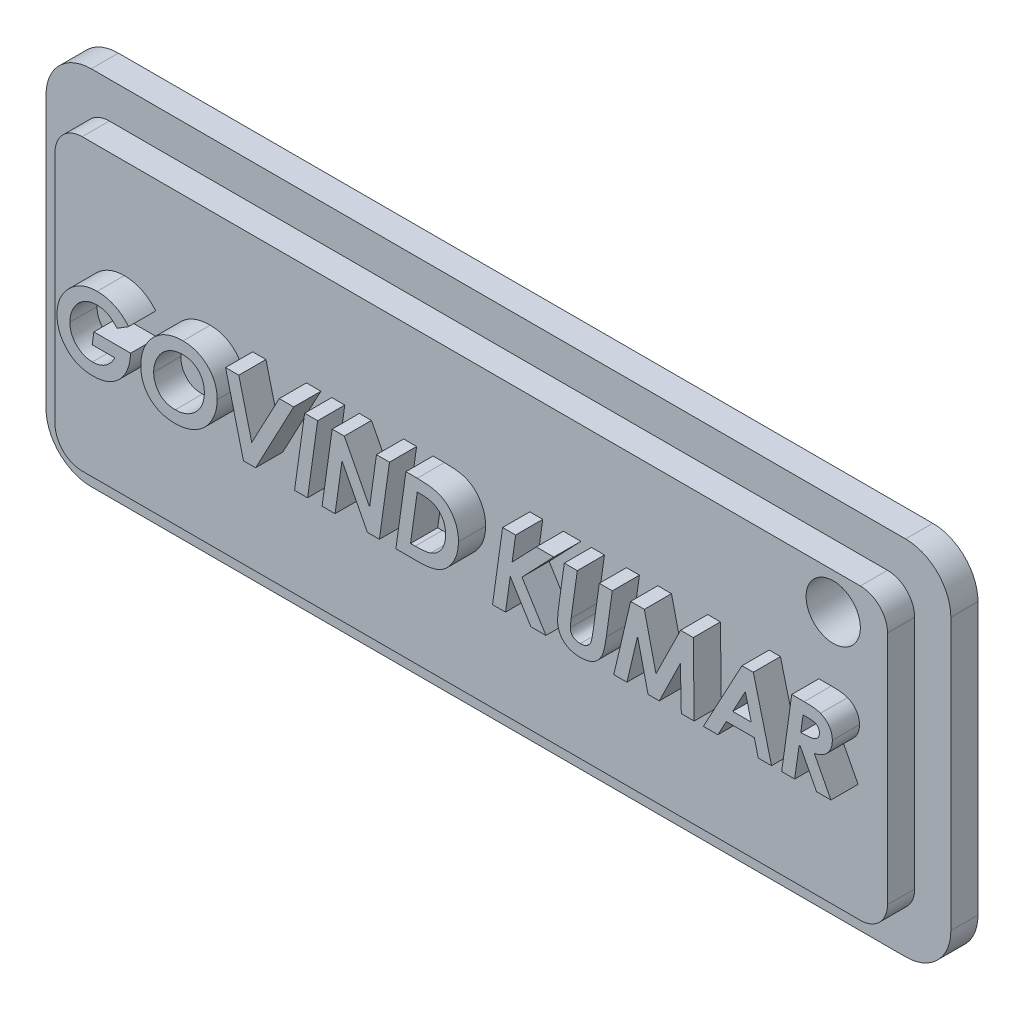
from build123d import *

# Parameters (mm, degrees)
BOSS_EXTRUDE1_DEPTH = 1.5
BOSS_EXTRUDE2_DEPTH = 1.5
BOSS_EXTRUDE3_DEPTH = 1.5
SKETCH4_R           = 1.5
CUT_EXTRUDE1_DEPTH  = 3


with BuildPart() as part:
    # Sketch1 → Boss-Extrude1 (new body)
    with BuildSketch(Plane.XY):
        with BuildLine():
            Line((-22.5, -10), (22.5, -10))
            ThreePointArc((22.5, -10), (24.267766953, -9.267766953), (25, -7.5))
            Line((25, -7.5), (25, 7.5))
            ThreePointArc((25, 7.5), (24.267766953, 9.267766953), (22.5, 10))
            Line((22.5, 10), (-22.5, 10))
            ThreePointArc((-22.5, 10), (-24.267766953, 9.267766953), (-25, 7.5))
            Line((-25, 7.5), (-25, -7.5))
            ThreePointArc((-25, -7.5), (-24.267766953, -9.267766953), (-22.5, -10))
        make_face()
    extrude(amount=BOSS_EXTRUDE1_DEPTH)

    # Sketch2 → Boss-Extrude2 (add)
    with BuildSketch(Plane.XY.offset(1.5)):
        with BuildLine():
            Line((-21.5, -8), (21.5, -8))
            ThreePointArc((21.5, -8), (22.560660172, -7.560660172), (23, -6.5))
            Line((23, -6.5), (23, 6.5))
            ThreePointArc((23, 6.5), (22.560660172, 7.560660172), (21.5, 8))
            Line((21.5, 8), (-21.5, 8))
            ThreePointArc((-21.5, 8), (-22.560660172, 7.560660172), (-23, 6.5))
            Line((-23, 6.5), (-23, -6.5))
            ThreePointArc((-23, -6.5), (-22.560660172, -7.560660172), (-21.5, -8))
        make_face()
    extrude(amount=BOSS_EXTRUDE2_DEPTH)

    # Sketch3 → Boss-Extrude3 (add)
    # profile 1 of 11: a face of its own
    with BuildSketch(Plane.XY.offset(3)):
        with BuildLine():
            Line((-17.439481473, 1.690738202), (-18.071523991, 1.294817229))
            add(Edge.make_bspline(
                [(-18.071523991, 1.294817229), (-18.116351478, 1.343784053), (-18.201988278, 1.437328493), (-18.336309952, 1.559636375), (-18.468627622, 1.658135293), (-18.600990723, 1.733121209), (-18.736411558, 1.788807334), (-18.87867327, 1.826272761), (-19.029256706, 1.850098156), (-19.132520964, 1.853018649), (-19.185349863, 1.854512741)],
                knots=[0, 0, 0, 0, 1.232977487, 2.355435308, 3.369770187, 4.291348691, 5.174604885, 6.082334442, 7.018942652, 8, 8, 8, 8], degree=3))
            add(Edge.make_bspline(
                [(-19.185349863, 1.854512741), (-19.242711013, 1.852992324), (-19.355446057, 1.850004163), (-19.519870343, 1.821727312), (-19.676535594, 1.778480084), (-19.82477147, 1.715839158), (-19.964667545, 1.634784512), (-20.096391673, 1.536322731), (-20.220035956, 1.420358313), (-20.292960555, 1.331977147), (-20.330181593, 1.286867008)],
                knots=[0, 0, 0, 0, 1.037106879, 2.038283569, 3.009830787, 3.972569298, 4.94146214, 5.928319872, 6.942605276, 8, 8, 8, 8], degree=3))
            add(Edge.make_bspline(
                [(-20.330181593, 1.286867008), (-20.358142366, 1.249157914), (-20.413377543, 1.174665393), (-20.483883061, 1.056114608), (-20.544637786, 0.935391205), (-20.594442716, 0.811287074), (-20.632551251, 0.684045293), (-20.659466099, 0.55341511), (-20.67686392, 0.419966779), (-20.678945092, 0.329713963), (-20.679991289, 0.284344222)],
                knots=[0, 0, 0, 0, 1.040960542, 2.056368018, 3.055559505, 4.03710588, 5.019268411, 5.998275661, 6.99374091, 8, 8, 8, 8], degree=3))
            add(Edge.make_bspline(
                [(-20.679991289, 0.284344222), (-20.678920736, 0.240042182), (-20.676810264, 0.152705792), (-20.660183607, 0.024498406), (-20.630884437, -0.097939322), (-20.592466031, -0.215537592), (-20.541018732, -0.327230591), (-20.478746549, -0.433520932), (-20.40513934, -0.534120687), (-20.321114053, -0.628191381), (-20.229175747, -0.714078375), (-20.131019193, -0.789357335), (-20.027601877, -0.852720413), (-19.918882334, -0.904605902), (-19.80492823, -0.945444581), (-19.685460159, -0.973766127), (-19.56116317, -0.991989571), (-19.476392792, -0.993884907), (-19.433396738, -0.994846233)],
                knots=[0, 0, 0, 0, 1.066897471, 2.103265977, 3.106535126, 4.095591644, 5.078159493, 6.062322472, 7.058152725, 8.075375883, 9.096057735, 10.084186963, 11.049730852, 12.011871914, 12.980953841, 13.959387168, 14.96498868, 16, 16, 16, 16], degree=3))
            add(Edge.make_bspline(
                [(-19.433396738, -0.994846233), (-19.40104241, -0.99424679), (-19.336986338, -0.993059995), (-19.242139745, -0.983240949), (-19.149445616, -0.967292368), (-19.059027221, -0.94525272), (-18.970894127, -0.916273433), (-18.88486051, -0.881146441), (-18.800689123, -0.840102091), (-18.719317713, -0.791931497), (-18.640615922, -0.738183764), (-18.565696355, -0.677513718), (-18.494726944, -0.610297392), (-18.427138777, -0.536888786), (-18.362490402, -0.457679315), (-18.303087298, -0.371014097), (-18.246276757, -0.278805573), (-18.212130201, -0.213817343), (-18.194752407, -0.180743669)],
                knots=[0, 0, 0, 0, 0.990751711, 1.961520103, 2.916931976, 3.869720035, 4.809138875, 5.755683625, 6.713987145, 7.674487982, 8.649319602, 9.630449541, 10.623757948, 11.640402946, 12.684918653, 13.752145235, 14.856026455, 16, 16, 16, 16], degree=3))
            Line((-18.194752407, -0.180743669), (-19.447707134, -0.180743669))
            Line((-19.447707134, -0.180743669), (-19.357074622, 0.480714664))
            Line((-19.357074622, 0.480714664), (-17.321818212, 0.480714664))
            add(Edge.make_bspline(
                [(-17.321818212, 0.480714664), (-17.326909079, 0.400823684), (-17.33686448, 0.24459357), (-17.372892264, 0.01710392), (-17.426250851, -0.197435004), (-17.495415964, -0.399849809), (-17.5810859, -0.58976296), (-17.684592095, -0.766659704), (-17.803906474, -0.931205137), (-17.940112922, -1.081242191), (-18.08925953, -1.215868382), (-18.248557952, -1.334806933), (-18.419217703, -1.433464539), (-18.598963806, -1.514961655), (-18.788503697, -1.57906014), (-18.988319277, -1.62399739), (-19.198083731, -1.651696479), (-19.341352245, -1.654749646), (-19.414316209, -1.656304566)],
                knots=[0, 0, 0, 0, 1.148955532, 2.246830018, 3.301660101, 4.319666133, 5.314146826, 6.287838685, 7.257462643, 8.227280698, 9.191724348, 10.138440807, 11.076252923, 12.016254752, 12.968042649, 13.943717582, 14.952773983, 16, 16, 16, 16], degree=3))
            add(Edge.make_bspline(
                [(-19.414316209, -1.656304566), (-19.454344702, -1.655907645), (-19.533423689, -1.6551235), (-19.65019217, -1.647068102), (-19.763679591, -1.633315318), (-19.873814636, -1.615250845), (-19.981082877, -1.592161826), (-20.084932806, -1.563728862), (-20.185605403, -1.52955106), (-20.2824708, -1.489056712), (-20.377591603, -1.446330909), (-20.468015471, -1.395432512), (-20.555965486, -1.340799677), (-20.640058789, -1.280071301), (-20.721562994, -1.214861413), (-20.799243437, -1.144126722), (-20.873779835, -1.068147444), (-20.920374162, -1.014186181), (-20.943938605, -0.986896013)],
                knots=[0, 0, 0, 0, 1.111499042, 2.195841241, 3.24834816, 4.285223882, 5.294222847, 6.294054786, 7.273859608, 8.244193736, 9.208986092, 10.167555097, 11.123181443, 12.083077344, 13.046240314, 14.020501641, 14.998895854, 16, 16, 16, 16], degree=3))
            add(Edge.make_bspline(
                [(-20.943938605, -0.986896013), (-20.979757951, -0.941658601), (-21.050875835, -0.851841523), (-21.142172346, -0.707120728), (-21.220082738, -0.556191883), (-21.282474445, -0.398283857), (-21.332353846, -0.234615366), (-21.367172913, -0.064286971), (-21.388120833, 0.112357925), (-21.390915984, 0.232345601), (-21.392331032, 0.293089464)],
                knots=[0, 0, 0, 0, 0.999328569, 1.984127054, 2.959716786, 3.938705326, 4.922250225, 5.921072174, 6.947541011, 8, 8, 8, 8], degree=3))
            add(Edge.make_bspline(
                [(-21.392331032, 0.293089464), (-21.390430304, 0.367408868), (-21.386679701, 0.514059254), (-21.354340299, 0.7296697), (-21.304037845, 0.938015859), (-21.230845716, 1.138054377), (-21.138451577, 1.330920477), (-21.024311009, 1.515134328), (-20.891188632, 1.692745358), (-20.73792198, 1.85891835), (-20.571711119, 2.012494446), (-20.395221231, 2.147395591), (-20.210154426, 2.260945648), (-20.018020619, 2.354978534), (-19.816985815, 2.426475285), (-19.608816974, 2.478220084), (-19.392519767, 2.510285072), (-19.245617261, 2.51405646), (-19.171039466, 2.515971075)],
                knots=[0, 0, 0, 0, 1.022519879, 2.01768214, 2.99445506, 3.968403767, 4.944092992, 5.933246428, 6.946641619, 7.994936793, 9.040543676, 10.058341478, 11.047494914, 12.024771785, 12.997483176, 13.978673844, 14.973836105, 16, 16, 16, 16], degree=3))
            add(Edge.make_bspline(
                [(-19.171039466, 2.515971075), (-19.115066079, 2.515063972), (-19.00360935, 2.513257707), (-18.837933718, 2.493692794), (-18.674059245, 2.464940108), (-18.513573203, 2.422362574), (-18.357529816, 2.370434839), (-18.20804842, 2.308271009), (-18.06657112, 2.236068434), (-17.932049674, 2.153105964), (-17.803148356, 2.058431366), (-17.677430576, 1.950286014), (-17.555289882, 1.827107764), (-17.478640327, 1.736849497), (-17.439481473, 1.690738202)],
                knots=[0, 0, 0, 0, 1.014010841, 2.019144067, 3.019687909, 4.027399918, 5.025300219, 5.998481464, 6.958680332, 7.901091373, 8.859847597, 9.854378501, 10.903841272, 12, 12, 12, 12], degree=3))
        make_face()
    # profile 2 of 11: a face of its own
    with BuildSketch(Plane.XY.offset(3)):
        with BuildLine():
            add(Edge.make_bspline(
                [(-14.425552937, 2.515971075), (-14.358691038, 2.514567836), (-14.227409686, 2.51181262), (-14.034979258, 2.48645795), (-13.851396786, 2.445591464), (-13.677109562, 2.386989893), (-13.511448406, 2.312957129), (-13.354811948, 2.221721192), (-13.207371221, 2.11392602), (-13.070326738, 1.991032203), (-12.946190525, 1.855625294), (-12.836107828, 1.710697643), (-12.744685341, 1.555590035), (-12.669396417, 1.39202964), (-12.610046554, 1.219837619), (-12.569561411, 1.038186498), (-12.542838002, 0.848279909), (-12.540272266, 0.718520324), (-12.538965648, 0.652439424)],
                knots=[0, 0, 0, 0, 1.079937363, 2.120424901, 3.130164457, 4.114608815, 5.086352068, 6.057283592, 7.037967613, 8.032612779, 9.026667848, 10.002130715, 10.967845321, 11.92966918, 12.907375778, 13.904589319, 14.932898699, 16, 16, 16, 16], degree=3))
            add(Edge.make_bspline(
                [(-12.538965648, 0.652439424), (-12.539802452, 0.600989437), (-12.54146679, 0.498659401), (-12.557303752, 0.346504988), (-12.581975598, 0.19650988), (-12.615757225, 0.048630784), (-12.660977288, -0.096658004), (-12.714955575, -0.240217306), (-12.779349644, -0.381459762), (-12.853302765, -0.519291366), (-12.934316715, -0.652088574), (-13.023112962, -0.777658181), (-13.118507177, -0.895254954), (-13.220133248, -1.005341861), (-13.329088534, -1.106445126), (-13.44324346, -1.200682782), (-13.565070989, -1.285912784), (-13.692637109, -1.36376337), (-13.826208434, -1.432951795), (-13.964882389, -1.492751915), (-14.108478492, -1.542750278), (-14.256657683, -1.584085861), (-14.409785959, -1.616970772), (-14.567834967, -1.639687666), (-14.73086015, -1.653474311), (-14.841057251, -1.655351549), (-14.897001004, -1.656304566)],
                knots=[0, 0, 0, 0, 1.005311864, 1.999487392, 2.986390894, 3.975195422, 4.961487101, 5.958115224, 6.97104375, 7.992937587, 9.013623077, 10.009524137, 10.996414046, 11.971324635, 12.935123389, 13.899409138, 14.862205298, 15.838449601, 16.81836937, 17.799766407, 18.787539403, 19.787875373, 20.804768927, 21.846385261, 22.906674593, 24, 24, 24, 24], degree=3))
            add(Edge.make_bspline(
                [(-14.897001004, -1.656304566), (-14.966243819, -1.654877607), (-15.101448444, -1.652091304), (-15.298499935, -1.627482781), (-15.484939704, -1.589060388), (-15.660776344, -1.53405585), (-15.826337423, -1.4631284), (-15.981076584, -1.376097676), (-16.125372711, -1.27391257), (-16.256806865, -1.155848778), (-16.376320705, -1.026343877), (-16.478948348, -0.884321026), (-16.567573368, -0.733614449), (-16.637884686, -0.571754723), (-16.694146209, -0.400728092), (-16.733344419, -0.219550728), (-16.757857362, -0.028507721), (-16.760679319, 0.102207538), (-16.762122699, 0.169066027)],
                knots=[0, 0, 0, 0, 1.129126937, 2.20475128, 3.23403939, 4.230775744, 5.204839333, 6.16680792, 7.121629951, 8.083044708, 9.04383724, 9.990659777, 10.936010704, 11.890255174, 12.863608629, 13.868449271, 14.909750384, 16, 16, 16, 16], degree=3))
            add(Edge.make_bspline(
                [(-16.762122699, 0.169066027), (-16.76038858, 0.24548842), (-16.756974008, 0.395968198), (-16.726958031, 0.61747275), (-16.681077804, 0.831284557), (-16.613475463, 1.036267545), (-16.52821952, 1.233199544), (-16.423211625, 1.421424871), (-16.300078817, 1.602469822), (-16.204081007, 1.713882655), (-16.155520886, 1.770240406)],
                knots=[0, 0, 0, 0, 1.045740506, 2.05911896, 3.05467723, 4.035585325, 5.008815224, 5.988058098, 6.982266978, 8, 8, 8, 8], degree=3))
            add(Edge.make_bspline(
                [(-16.155520886, 1.770240406), (-16.127252542, 1.800797182), (-16.071224818, 1.861360568), (-15.98155592, 1.945524317), (-15.889691993, 2.024322055), (-15.794332722, 2.096818354), (-15.696918314, 2.164696997), (-15.595896468, 2.225818616), (-15.491649326, 2.280846453), (-15.385310675, 2.331024679), (-15.275050835, 2.373869231), (-15.162775705, 2.412257975), (-15.046927172, 2.443932274), (-14.928321719, 2.47014844), (-14.806845813, 2.490993736), (-14.682338057, 2.504983566), (-14.555010273, 2.514036886), (-14.469029691, 2.5153215), (-14.425552937, 2.515971075)],
                knots=[0, 0, 0, 0, 1.027812829, 2.037120149, 3.035266778, 4.015768311, 4.994345575, 5.966422343, 6.929711672, 7.904780536, 8.86860337, 9.849672715, 10.834163809, 11.833018336, 12.848777673, 13.876590502, 14.926281379, 16, 16, 16, 16], degree=3))
        make_face()
        with BuildLine():
            add(Edge.make_bspline(
                [(-14.4422484, 1.854512741), (-14.47831528, 1.853973548), (-14.550070053, 1.852900828), (-14.656275525, 1.842113041), (-14.760344406, 1.825398278), (-14.861839432, 1.80249166), (-14.961247549, 1.772928188), (-15.057891954, 1.736393356), (-15.152486695, 1.693155802), (-15.243988877, 1.643264238), (-15.332705455, 1.587628209), (-15.4167839, 1.525537503), (-15.496815437, 1.45788097), (-15.571452994, 1.383465782), (-15.64233557, 1.303820972), (-15.709264739, 1.218785675), (-15.77140458, 1.127531677), (-15.829031477, 1.03157689), (-15.880185805, 0.931708274), (-15.925622222, 0.830998407), (-15.964291559, 0.729432955), (-15.994958638, 0.626735765), (-16.019993192, 0.523318529), (-16.037352356, 0.41890877), (-16.048130658, 0.313725143), (-16.049231607, 0.243293698), (-16.049782955, 0.208022106)],
                knots=[0, 0, 0, 0, 1.015557909, 2.02044445, 3.003357477, 3.982977463, 4.948851735, 5.922052592, 6.890662853, 7.875953625, 8.855459861, 9.837777552, 10.817397539, 11.804383193, 12.803598646, 13.818964529, 14.849984807, 15.911175445, 16.969421976, 18.008462528, 19.021851172, 20.027762868, 21.025304218, 22.016795393, 23.006824523, 24, 24, 24, 24], degree=3))
            add(Edge.make_bspline(
                [(-16.049782955, 0.208022106), (-16.048912528, 0.166899465), (-16.047199914, 0.085988415), (-16.032276487, -0.033117601), (-16.009154088, -0.147788064), (-15.974164878, -0.257072591), (-15.931649869, -0.362152789), (-15.87767036, -0.461458158), (-15.815618168, -0.556952288), (-15.743498049, -0.646209504), (-15.662943927, -0.728617854), (-15.572064917, -0.799714951), (-15.473173404, -0.860423242), (-15.365844663, -0.909823679), (-15.250167125, -0.948380617), (-15.125843321, -0.974580866), (-14.993420307, -0.991942693), (-14.902359138, -0.993861965), (-14.855659859, -0.994846233)],
                knots=[0, 0, 0, 0, 1.032572517, 2.031642993, 3.01079972, 3.966643664, 4.909863955, 5.853952978, 6.801111379, 7.766917104, 8.731873648, 9.689385086, 10.65752794, 11.640388645, 12.650815691, 13.713650281, 14.827481725, 16, 16, 16, 16], degree=3))
            add(Edge.make_bspline(
                [(-14.855659859, -0.994846233), (-14.800994235, -0.993554637), (-14.693051208, -0.991004244), (-14.534501828, -0.968288685), (-14.382301658, -0.930579963), (-14.236437632, -0.87905052), (-14.096862761, -0.812355864), (-13.963573582, -0.730956422), (-13.836914012, -0.63407569), (-13.717902939, -0.524247748), (-13.608577028, -0.404373613), (-13.513011438, -0.276259866), (-13.431853398, -0.141593215), (-13.365731455, -0.000668139), (-13.314570643, 0.146752568), (-13.278099939, 0.300409895), (-13.255084778, 0.460407068), (-13.252575874, 0.569413806), (-13.251305391, 0.624613653)],
                knots=[0, 0, 0, 0, 1.03369803, 2.041145535, 3.022357397, 3.995919545, 4.96236968, 5.943376615, 6.945032455, 7.973917545, 9.003120129, 10.009769043, 10.992465341, 11.972511115, 12.949140339, 13.93890809, 14.956285095, 16, 16, 16, 16], degree=3))
            add(Edge.make_bspline(
                [(-13.251305391, 0.624613653), (-13.252038331, 0.669982443), (-13.253474727, 0.758895034), (-13.270059853, 0.888366128), (-13.29525324, 1.011082408), (-13.330668462, 1.127005947), (-13.378370056, 1.235484571), (-13.43433232, 1.337853639), (-13.502106926, 1.432376432), (-13.578910482, 1.519365464), (-13.663823269, 1.598407579), (-13.756442773, 1.666558338), (-13.854754996, 1.725729491), (-13.960441366, 1.771892123), (-14.071589503, 1.810181089), (-14.189509481, 1.835922972), (-14.313850163, 1.85112484), (-14.398743188, 1.853364818), (-14.4422484, 1.854512741)],
                knots=[0, 0, 0, 0, 1.12845219, 2.211511647, 3.242392028, 4.243671568, 5.221368115, 6.186708094, 7.141970352, 8.109200861, 9.070590294, 10.022934043, 10.966237583, 11.91979086, 12.887493425, 13.887534174, 14.917422563, 16, 16, 16, 16], degree=3))
        make_face(mode=Mode.SUBTRACT)
    # profile 3 of 11: a face of its own
    with BuildSketch(Plane.XY.offset(3)):
        Polygon((-12.079442911, 2.414208254), (-11.346432595, 2.414208254), (-10.630912763, -0.451051161), (-9.11003561, 2.414208254), (-8.310243442, 2.414208254), (-10.417846858, -1.554541746), (-11.088050433, -1.554541746), align=None)
    # profile 4 of 11: a face of its own
    with BuildSketch(Plane.XY.offset(3)):
        Polygon((-7.708411762, 2.414208254), (-6.989711842, 2.414208254), (-7.546227266, -1.554541746), (-8.264927186, -1.554541746), align=None)
    # profile 5 of 11: a face of its own
    with BuildSketch(Plane.XY.offset(3)):
        Polygon((-6.186739586, 2.414208254), (-5.518126054, 2.414208254), (-4.11809225, -0.284096533), (-3.739661762, 2.414208254), (-3.020961842, 2.414208254), (-3.576682244, -1.554541746), (-4.239730622, -1.554541746), (-5.644534558, 1.173178857), (-6.026145135, -1.554541746), (-6.744845055, -1.554541746), align=None)
    # profile 6 of 11: a face of its own
    with BuildSketch(Plane.XY.offset(3)):
        with BuildLine():
            Line((-2.111456633, 2.414208254), (-1.48497927, 2.414208254))
            add(Edge.make_bspline(
                [(-1.48497927, 2.414208254), (-1.413947364, 2.413621593), (-1.276585451, 2.412487104), (-1.077386576, 2.403132959), (-0.89251271, 2.386622578), (-0.721625573, 2.363771063), (-0.564711273, 2.334616592), (-0.421709879, 2.299314201), (-0.292478866, 2.257550335), (-0.176658133, 2.207369921), (-0.07001469, 2.151060273), (0.029924861, 2.086808246), (0.124881819, 2.015416282), (0.215496531, 1.937336105), (0.299932204, 1.850852653), (0.379377075, 1.756877504), (0.454135234, 1.655614379), (0.523954476, 1.548114531), (0.58675752, 1.434453572), (0.641620824, 1.315655312), (0.688724353, 1.192846399), (0.725980585, 1.06535268), (0.755432751, 0.933897061), (0.776842712, 0.797967089), (0.78991209, 0.657733137), (0.791274411, 0.562895199), (0.791963839, 0.514900612)],
                knots=[0, 0, 0, 0, 1.508928034, 2.917973822, 4.235011166, 5.450779055, 6.579221784, 7.623755204, 8.577985451, 9.460610614, 10.301756591, 11.137250569, 11.981705789, 12.823774396, 13.675702816, 14.546470419, 15.435981066, 16.347923198, 17.267651715, 18.192054867, 19.125737078, 20.059147693, 21.011116727, 21.985721956, 22.980635317, 24, 24, 24, 24], degree=3))
            add(Edge.make_bspline(
                [(0.791963839, 0.514900612), (0.790995148, 0.465314506), (0.789069738, 0.366755196), (0.775254084, 0.220702704), (0.7529114, 0.077607961), (0.722114367, -0.062479305), (0.681553637, -0.199614971), (0.630909149, -0.333076496), (0.573243466, -0.464198784), (0.505478838, -0.590285199), (0.43239894, -0.711347577), (0.353276811, -0.824545654), (0.270290676, -0.929757258), (0.18135385, -1.025539004), (0.088174683, -1.113255821), (-0.009281426, -1.192905687), (-0.112065818, -1.263383743), (-0.220062876, -1.325942091), (-0.336147859, -1.380779582), (-0.462097901, -1.427234825), (-0.598300089, -1.467162086), (-0.745406332, -1.498332223), (-0.902714885, -1.523778089), (-1.070674364, -1.542003543), (-1.249265651, -1.551980859), (-1.37180913, -1.553671451), (-1.434892881, -1.554541746)],
                knots=[0, 0, 0, 0, 1.035326767, 2.057856534, 3.060426681, 4.057975219, 5.050723532, 6.043595218, 7.036960241, 8.039530388, 9.030318104, 9.988216712, 10.921569661, 11.826132526, 12.714780289, 13.59198308, 14.451536877, 15.31430869, 16.195534129, 17.128821459, 18.114698389, 19.15667332, 20.266554844, 21.441073174, 22.682698532, 24, 24, 24, 24], degree=3))
            Line((-1.434892881, -1.554541746), (-2.667972058, -1.554541746))
            Line((-2.667972058, -1.554541746), (-2.111456633, 2.414208254))
        make_face()
        with BuildLine():
            Line((-1.485774292, 1.752749921), (-1.85625456, -0.893083412))
            Line((-1.85625456, -0.893083412), (-1.599462443, -0.893083412))
            add(Edge.make_bspline(
                [(-1.599462443, -0.893083412), (-1.551754481, -0.892839064), (-1.460023164, -0.892369238), (-1.327514377, -0.887109552), (-1.205192122, -0.880848056), (-1.093119661, -0.869221271), (-0.990887493, -0.856283811), (-0.899190084, -0.839428626), (-0.816972758, -0.821311582), (-0.766951159, -0.804205088), (-0.743223711, -0.796090724)],
                knots=[0, 0, 0, 0, 1.323091274, 2.54399687, 3.677836413, 4.719289959, 5.668358043, 6.534823038, 7.305002022, 8, 8, 8, 8], degree=3))
            add(Edge.make_bspline(
                [(-0.743223711, -0.796090724), (-0.712736668, -0.784241442), (-0.652171349, -0.760701752), (-0.566757526, -0.714912389), (-0.483884596, -0.666381097), (-0.407176418, -0.609296915), (-0.33391388, -0.547330683), (-0.267027841, -0.477834945), (-0.203271124, -0.403365778), (-0.144903369, -0.322488847), (-0.091543838, -0.236501371), (-0.046103057, -0.144730808), (-0.006866058, -0.048396564), (0.024552775, 0.053297466), (0.049447041, 0.159548357), (0.066454375, 0.270671575), (0.078328197, 0.386644857), (0.079186971, 0.465842821), (0.079624096, 0.50615537)],
                knots=[0, 0, 0, 0, 0.952655881, 1.892538673, 2.821337892, 3.750040712, 4.676008024, 5.615700279, 6.558436491, 7.532008524, 8.520486916, 9.505184105, 10.513747313, 11.549809891, 12.604882282, 13.692134403, 14.825273528, 16, 16, 16, 16], degree=3))
            add(Edge.make_bspline(
                [(0.079624096, 0.50615537), (0.079167303, 0.539291933), (0.078274528, 0.604055489), (0.071259402, 0.699147548), (0.058257048, 0.790132502), (0.041239471, 0.877061206), (0.018621751, 0.959857719), (-0.008330044, 1.038504734), (-0.039728192, 1.113571698), (-0.089978593, 1.206165832), (-0.161606495, 1.314194294), (-0.266239826, 1.428376971), (-0.387832321, 1.525919427), (-0.501168996, 1.594085373), (-0.600079055, 1.640728043), (-0.681310657, 1.67059438), (-0.768402857, 1.696232425), (-0.861506393, 1.716309686), (-0.960072673, 1.733559423), (-1.064775552, 1.743902035), (-1.17533705, 1.751562725), (-1.251227798, 1.752347121), (-1.290198871, 1.752749921)],
                knots=[0, 0, 0, 0, 0.941373656, 1.839862062, 2.706559874, 3.551131217, 4.354742518, 5.142827075, 5.911946928, 6.663057697, 8.133107042, 9.582556681, 11.0440985, 12.547036792, 13.328439944, 14.147940985, 15.003216405, 15.905576335, 16.852443473, 17.844335315, 18.893032825, 20, 20, 20, 20], degree=3))
            Line((-1.290198871, 1.752749921), (-1.485774292, 1.752749921))
        make_face(mode=Mode.SUBTRACT)
    # profile 7 of 11: a face of its own
    with BuildSketch(Plane.XY.offset(3)):
        Polygon((3.231091444, 2.414208254), (3.949791363, 2.414208254), (3.754215943, 1.016559516), (5.091443006, 2.414208254), (6.058189801, 2.414208254), (4.302781147, 0.578502375), (5.62410777, -1.554541746), (4.793309743, -1.554541746), (3.6516581, 0.285934266), (3.393275939, -1.554541746), (2.674576019, -1.554541746), align=None)
    # profile 8 of 11: a face of its own
    with BuildSketch(Plane.XY.offset(3)):
        with BuildLine():
            Line((6.640145931, 2.414208254), (7.358845851, 2.414208254))
            Line((7.358845851, 2.414208254), (7.016191353, -0.040819791))
            add(Edge.make_bspline(
                [(7.016191353, -0.040819791), (7.012690355, -0.067313397), (7.005972565, -0.118149891), (6.997177512, -0.19155639), (6.989970432, -0.258870016), (6.984536891, -0.320128668), (6.979864542, -0.375253352), (6.975274867, -0.424215563), (6.974042909, -0.467476463), (6.973508697, -0.494247808), (6.973260164, -0.506702703)],
                knots=[0, 0, 0, 0, 1.370131483, 2.629037392, 3.790386942, 4.840899086, 5.781938864, 6.627066857, 7.36126714, 8, 8, 8, 8], degree=3))
            add(Edge.make_bspline(
                [(6.973260164, -0.506702703), (6.974778242, -0.543173387), (6.977681617, -0.612924758), (7.004169147, -0.711628282), (7.04969226, -0.796959267), (7.112170621, -0.869620093), (7.192533342, -0.926934423), (7.289814123, -0.966099455), (7.401831683, -0.991299381), (7.481922277, -0.993620613), (7.524210434, -0.994846233)],
                knots=[0, 0, 0, 0, 1.044998619, 1.998593913, 2.903381636, 3.798178852, 4.724466667, 5.705876195, 6.788693348, 8, 8, 8, 8], degree=3))
            add(Edge.make_bspline(
                [(7.524210434, -0.994846233), (7.559286945, -0.993663427), (7.627554008, -0.991361411), (7.726349735, -0.972313759), (7.818939656, -0.942994278), (7.874943366, -0.912791049), (7.902640923, -0.897853545)],
                knots=[0, 0, 0, 0, 1.064320597, 2.071415827, 3.046186936, 4, 4, 4, 4], degree=3))
            add(Edge.make_bspline(
                [(7.902640923, -0.897853545), (7.922227225, -0.884436363), (7.962264141, -0.857009921), (8.014526306, -0.802259391), (8.059461135, -0.735522052), (8.092052762, -0.670793912), (8.115724623, -0.609564341), (8.13397944, -0.55227423), (8.150759203, -0.484322856), (8.169564881, -0.40662349), (8.186344271, -0.318405964), (8.204362369, -0.220209503), (8.220362649, -0.11134485), (8.231517723, -0.035253897), (8.2373452, 0.004496465)],
                knots=[0, 0, 0, 0, 0.859785812, 1.75751252, 2.725816041, 3.770921983, 4.379908327, 5.106796295, 5.951169398, 6.919234109, 8.007475297, 9.209126838, 10.542031388, 12, 12, 12, 12], degree=3))
            Line((8.2373452, 0.004496465), (8.57363952, 2.414208254))
            Line((8.57363952, 2.414208254), (9.29233944, 2.414208254))
            Line((9.29233944, 2.414208254), (8.960815252, 0.040272457))
            add(Edge.make_bspline(
                [(8.960815252, 0.040272457), (8.952645626, -0.018341276), (8.936831465, -0.131801431), (8.908924227, -0.295047101), (8.8796876, -0.445389195), (8.848919512, -0.582869141), (8.815496685, -0.707436682), (8.781215461, -0.81973112), (8.743715055, -0.91864194), (8.704496964, -1.0062063), (8.661422661, -1.084547661), (8.615315718, -1.157303406), (8.564645458, -1.225185693), (8.507955407, -1.287106714), (8.449067221, -1.346493777), (8.38409534, -1.39948014), (8.31552987, -1.448477923), (8.242202658, -1.491913402), (8.164930108, -1.531385762), (8.08274981, -1.564323384), (7.997098732, -1.593124755), (7.90698185, -1.616180978), (7.813024541, -1.634442836), (7.714740271, -1.646794523), (7.612606439, -1.655250346), (7.543044118, -1.655948157), (7.507514971, -1.656304566)],
                knots=[0, 0, 0, 0, 1.689301192, 3.270025079, 4.726951413, 6.061161684, 7.290631986, 8.408026906, 9.411210366, 10.308389253, 11.14458747, 11.960942218, 12.765860093, 13.558707188, 14.355765744, 15.150991277, 15.948624031, 16.759492273, 17.581610214, 18.423095804, 19.284310986, 20.159533266, 21.076429259, 22.014764283, 22.986035413, 24, 24, 24, 24], degree=3))
            add(Edge.make_bspline(
                [(7.507514971, -1.656304566), (7.460031333, -1.655531516), (7.367723117, -1.654028705), (7.233252792, -1.638254481), (7.106799472, -1.614224455), (6.988179108, -1.579660199), (6.877183324, -1.536507662), (6.774826698, -1.481804177), (6.680163884, -1.417987072), (6.594220159, -1.344062925), (6.518303356, -1.260972226), (6.45027992, -1.171821559), (6.394938531, -1.073722735), (6.348612477, -0.969439631), (6.312479934, -0.857811429), (6.287759263, -0.738911503), (6.27097135, -0.612917357), (6.269582012, -0.526370753), (6.26887064, -0.48205702)],
                knots=[0, 0, 0, 0, 1.177265359, 2.288604451, 3.35342386, 4.366487498, 5.349088925, 6.301818939, 7.238910628, 8.175748691, 9.10608431, 10.02633368, 10.950892497, 11.892606604, 12.852970325, 13.854711106, 14.901565705, 16, 16, 16, 16], degree=3))
            add(Edge.make_bspline(
                [(6.26887064, -0.48205702), (6.268978805, -0.46111722), (6.269207571, -0.416829859), (6.272884346, -0.347138283), (6.277457442, -0.270248277), (6.284662337, -0.1864853), (6.294488166, -0.095636931), (6.305639883, 0.002149544), (6.318137655, 0.107159678), (6.328111732, 0.179416915), (6.333267425, 0.216767349)],
                knots=[0, 0, 0, 0, 0.71553134, 1.513337966, 2.384471215, 3.347928436, 4.386088841, 5.507247356, 6.711473103, 8, 8, 8, 8], degree=3))
            Line((6.333267425, 0.216767349), (6.640145931, 2.414208254))
        make_face()
    # profile 9 of 11: a face of its own
    with BuildSketch(Plane.XY.offset(3)):
        Polygon((10.305197513, 2.414208254), (11.062853513, 2.414208254), (11.706026339, -0.350878384), (13.063923976, 2.414208254), (13.766723455, 2.414208254), (13.817604865, -1.554541746), (13.105265121, -1.554541746), (13.054383711, 0.819394052), (11.888881407, -1.554541746), (11.267969198, -1.554541746), (10.688398134, 0.938647357), (10.102466894, -1.554541746), (9.372636666, -1.554541746), align=None)
    # profile 10 of 11: a face of its own
    with BuildSketch(Plane.XY.offset(3)):
        Polygon((16.459463088, 2.414208254), (17.084350408, 2.414208254), (18.091643327, -1.554541746), (17.35863301, -1.554541746), (17.139206928, -0.689557771), (15.592094048, -0.689557771), (15.127801179, -1.554541746), (14.326418968, -1.554541746), align=None)
        Polygon((16.969867235, -0.028099438), (16.642318156, 1.263811369), (15.94826392, -0.028099438), align=None, mode=Mode.SUBTRACT)
    # profile 11 of 11: a face of its own
    with BuildSketch(Plane.XY.offset(3)):
        with BuildLine():
            Line((19.207854264, 2.414208254), (19.897138369, 2.414208254))
            add(Edge.make_bspline(
                [(19.897138369, 2.414208254), (19.948290701, 2.413999217), (20.046918547, 2.413596167), (20.188748597, 2.407864809), (20.318924455, 2.399217954), (20.437291336, 2.387806717), (20.543948063, 2.371974264), (20.638672837, 2.352964233), (20.722070687, 2.331793914), (20.772084083, 2.312121073), (20.795513268, 2.302905169)],
                knots=[0, 0, 0, 0, 1.348808202, 2.600664361, 3.742342956, 4.788858012, 5.735658768, 6.584006912, 7.336666444, 8, 8, 8, 8], degree=3))
            add(Edge.make_bspline(
                [(20.795513268, 2.302905169), (20.821891518, 2.291009839), (20.873456821, 2.26775635), (20.947346895, 2.22834026), (21.016539198, 2.185878434), (21.079886992, 2.138769921), (21.138727111, 2.08899831), (21.192694694, 2.036090206), (21.241355188, 1.979233635), (21.285219276, 1.919448392), (21.324223032, 1.856811804), (21.357703739, 1.79101499), (21.386653926, 1.722615005), (21.409261623, 1.650867536), (21.428051336, 1.576633831), (21.440203842, 1.499445527), (21.448756201, 1.419562992), (21.449458944, 1.365333192), (21.449816403, 1.337748419)],
                knots=[0, 0, 0, 0, 1.116361014, 2.182309107, 3.229450697, 4.24598407, 5.225421932, 6.201651319, 7.158895679, 8.110002388, 9.060669178, 10.002827475, 10.956240434, 11.923213192, 12.902917952, 13.908279153, 14.936015885, 16, 16, 16, 16], degree=3))
            add(Edge.make_bspline(
                [(21.449816403, 1.337748419), (21.448975748, 1.303803456), (21.447316157, 1.236790605), (21.43647204, 1.137971141), (21.416246415, 1.043143606), (21.389008599, 0.952009285), (21.355263131, 0.863978093), (21.311743935, 0.780581839), (21.261441157, 0.700367445), (21.203346582, 0.624386574), (21.138411906, 0.551942223), (21.063435107, 0.487297825), (20.982564006, 0.426105861), (20.892476304, 0.372468982), (20.795649637, 0.322645097), (20.689875524, 0.280431274), (20.57713918, 0.241474431), (20.498090511, 0.221977074), (20.457628903, 0.211997217)],
                knots=[0, 0, 0, 0, 0.995453645, 1.965186658, 2.910129054, 3.83459069, 4.752398018, 5.669942118, 6.588407184, 7.525617038, 8.471772905, 9.435289717, 10.423772802, 11.441988612, 12.505459691, 13.613754905, 14.778583949, 16, 16, 16, 16], degree=3))
            Line((20.457628903, 0.211997217), (21.373494288, -1.554541746))
            Line((21.373494288, -1.554541746), (20.577677231, -1.554541746))
            Line((20.577677231, -1.554541746), (19.680892375, 0.175426203))
            Line((19.680892375, 0.175426203), (19.613315502, 0.175426203))
            Line((19.613315502, 0.175426203), (19.370038759, -1.554541746))
            Line((19.370038759, -1.554541746), (18.651338839, -1.554541746))
            Line((18.651338839, -1.554541746), (19.207854264, 2.414208254))
        make_face()
        with BuildLine():
            add(Edge.make_bspline(
                [(19.70633308, 0.836884536), (19.75748695, 0.837359527), (19.855331433, 0.838268066), (19.995072697, 0.844587611), (20.121087079, 0.854570197), (20.233011153, 0.868835964), (20.331139339, 0.885707203), (20.415054784, 0.906769741), (20.485142119, 0.931812715), (20.542506798, 0.961511182), (20.588976139, 0.996380078), (20.62919735, 1.033590657), (20.662688745, 1.07524378), (20.690322147, 1.120640178), (20.71163488, 1.169873946), (20.727004655, 1.223278634), (20.735502725, 1.280498162), (20.736809122, 1.319966224), (20.73747666, 1.340133485)],
                knots=[0, 0, 0, 0, 1.892208387, 3.619318591, 5.173427176, 6.566868293, 7.791773198, 8.8545744, 9.763297566, 10.539470204, 11.233547833, 11.906251103, 12.5615143, 13.203742025, 13.866659999, 14.539934446, 15.25394049, 16, 16, 16, 16], degree=3))
            add(Edge.make_bspline(
                [(20.73747666, 1.340133485), (20.736612558, 1.363000246), (20.734936318, 1.407358629), (20.720437529, 1.471247493), (20.695645099, 1.529203369), (20.660802717, 1.580672175), (20.617321297, 1.62605482), (20.564276349, 1.663432662), (20.502273999, 1.692856216), (20.444192586, 1.712295467), (20.389215485, 1.723555179), (20.337966234, 1.731120197), (20.277288552, 1.738420169), (20.206999923, 1.743818269), (20.127184845, 1.747389011), (20.037883953, 1.750858755), (19.939277402, 1.752092616), (19.870372448, 1.752524187), (19.834331628, 1.752749921)],
                knots=[0, 0, 0, 0, 0.974340854, 1.890087692, 2.776057671, 3.647490651, 4.526730822, 5.442477659, 6.397820337, 7.445016909, 8.045730266, 8.789007992, 9.653967296, 10.651691253, 11.794598421, 13.061237498, 14.462876682, 16, 16, 16, 16], degree=3))
            Line((19.834331628, 1.752749921), (19.70633308, 0.836884536))
        make_face(mode=Mode.SUBTRACT)
    extrude(amount=BOSS_EXTRUDE3_DEPTH)

    # Sketch4 → Cut-Extrude1 (cut)
    with BuildSketch(Plane.XY.offset(3)):
        with Locations((20, 6)):
            Circle(SKETCH4_R)
    extrude(amount=-CUT_EXTRUDE1_DEPTH, mode=Mode.SUBTRACT)


solid = part.part
